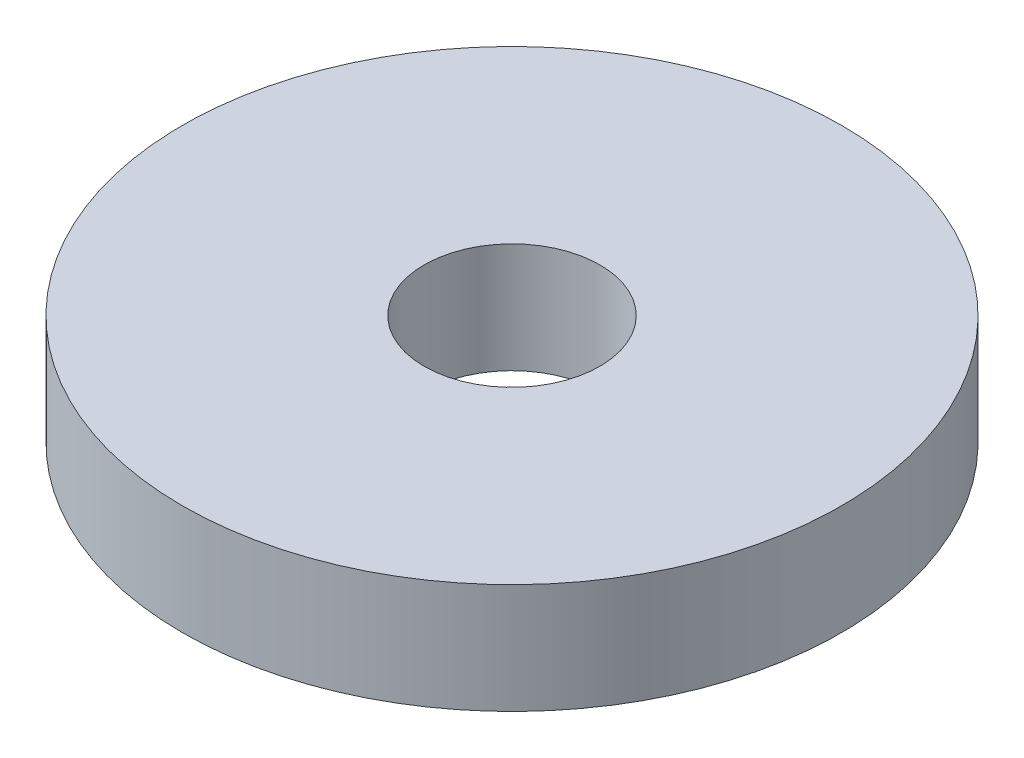
from build123d import *

# Parameters (mm, degrees)
SKETCH1_R           = 15
SKETCH1_R_2         = 4
BOSS_EXTRUDE1_DEPTH = 5


with BuildPart() as part:
    # Sketch1 → Boss-Extrude1 (new body)
    with BuildSketch(Plane(origin=(0, 0, 0), x_dir=(1, 0, 0), z_dir=(0, 1, 0))):
        with Locations(Location((0, 0, 0), (0, 0, 270))):
            Circle(SKETCH1_R)
        with Locations(Location((0, 0, 0), (0, 0, 270))):
            Circle(SKETCH1_R_2, mode=Mode.SUBTRACT)
    extrude(amount=BOSS_EXTRUDE1_DEPTH)


solid = part.part
